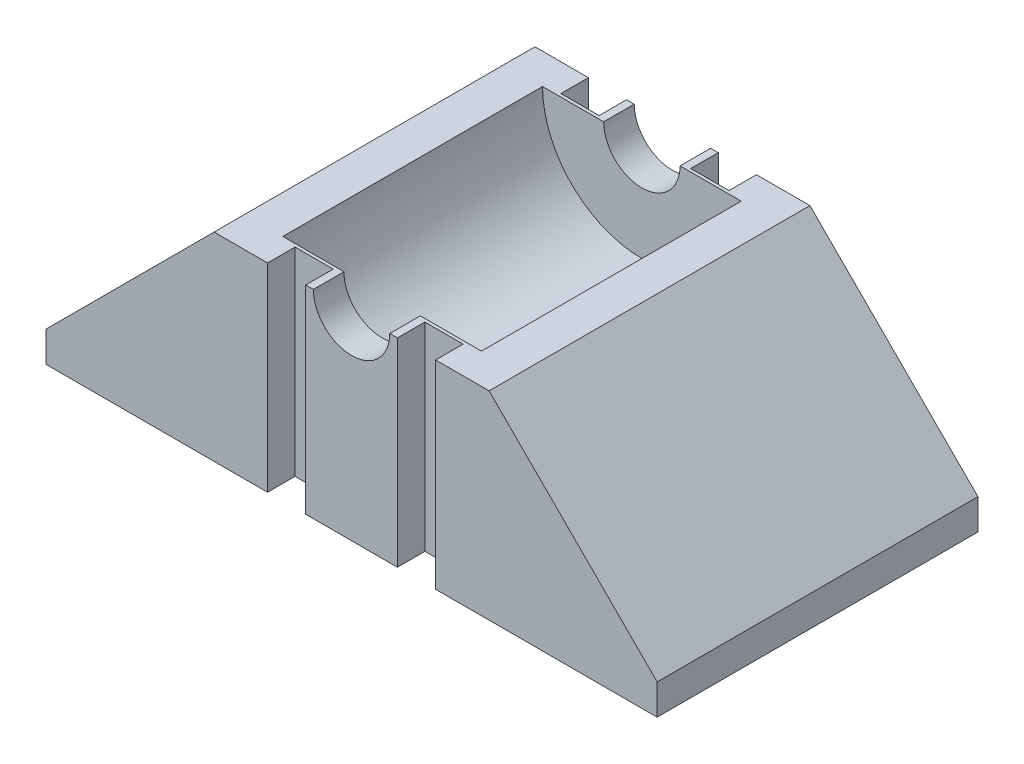
from build123d import *

# Parameters (mm, degrees)
SKETCH5_W           = 40
SKETCH5_H           = 13
BOSS_EXTRUDE2_DEPTH = 10.5
SKETCH6_R           = 6.5
CUT_EXTRUDE4_DEPTH  = 8.5
SKETCH7_R           = 2.5
CUT_EXTRUDE5_DEPTH  = 4.5
SKETCH8_R           = 4
CUT_EXTRUDE6_DEPTH  = 5
CHAMFER8_SIZE       = 11
SKETCH9_W           = 2.5
SKETCH9_H           = 1.8
CUT_EXTRUDE7_DEPTH  = 15


with BuildPart() as part:
    # Sketch5 → Boss-Extrude2 (new body)
    with BuildSketch(Plane.XY):
        with Locations((-20, 6.5)):
            Rectangle(SKETCH5_W, SKETCH5_H)
    boss_extrude2 = extrude(amount=BOSS_EXTRUDE2_DEPTH)

    # Sketch6 → Cut-Extrude4 (cut)
    with BuildSketch(Plane(origin=(0, 0, 0), x_dir=(-1, 0, 0), z_dir=(0, 0, -1))):
        with Locations((20, 13)):
            Circle(SKETCH6_R)
    cut_extrude4 = extrude(amount=-CUT_EXTRUDE4_DEPTH, mode=Mode.SUBTRACT)

    # Sketch7 → Cut-Extrude5 (cut)
    with BuildSketch(Plane.XY.offset(10.5)):
        with Locations((-20, 13)):
            Circle(SKETCH7_R)
    cut_extrude5 = extrude(amount=-CUT_EXTRUDE5_DEPTH, mode=Mode.SUBTRACT)

    # Mirror5: Boss-Extrude2, Cut-Extrude4, Cut-Extrude5 across plane
    add(boss_extrude2.mirror(Plane.XY))
    add(cut_extrude4.mirror(Plane.XY), mode=Mode.SUBTRACT)
    add(cut_extrude5.mirror(Plane.XY), mode=Mode.SUBTRACT)

    # Sketch8 → Cut-Extrude6 (cut)
    with BuildSketch(Plane.XZ):
        with Locations(Location((-31, 5.5, 0), (0, 0, 270))):
            Circle(SKETCH8_R)
        with Locations(Location((-9, 5.5, 0), (0, 0, 90))):
            Circle(SKETCH8_R)
        with Locations(Location((-9, -5.5, 0), (0, 0, 270))):
            Circle(SKETCH8_R)
        with Locations(Location((-31, -5.5, 0), (0, 0, 90))):
            Circle(SKETCH8_R)
    extrude(amount=-CUT_EXTRUDE6_DEPTH, mode=Mode.SUBTRACT)

    # Chamfer8
    chamfer8_edges = [part.edges().sort_by_distance(p)[0] for p in [
        (-40, 13, 0),
        (0, 13, 0),
    ]]
    chamfer(chamfer8_edges, length=CHAMFER8_SIZE)

    # Sketch9 → Cut-Extrude7 (cut)
    with BuildSketch(Plane.XZ):
        with Locations((-15.75, 9.6)):
            Rectangle(SKETCH9_W, SKETCH9_H)
        with Locations((-24.25, 9.6)):
            Rectangle(SKETCH9_W, SKETCH9_H)
        with Locations((-15.75, -9.6)):
            Rectangle(SKETCH9_W, SKETCH9_H)
        with Locations((-24.25, -9.6)):
            Rectangle(SKETCH9_W, SKETCH9_H)
    extrude(amount=-CUT_EXTRUDE7_DEPTH, mode=Mode.SUBTRACT)


solid = part.part
